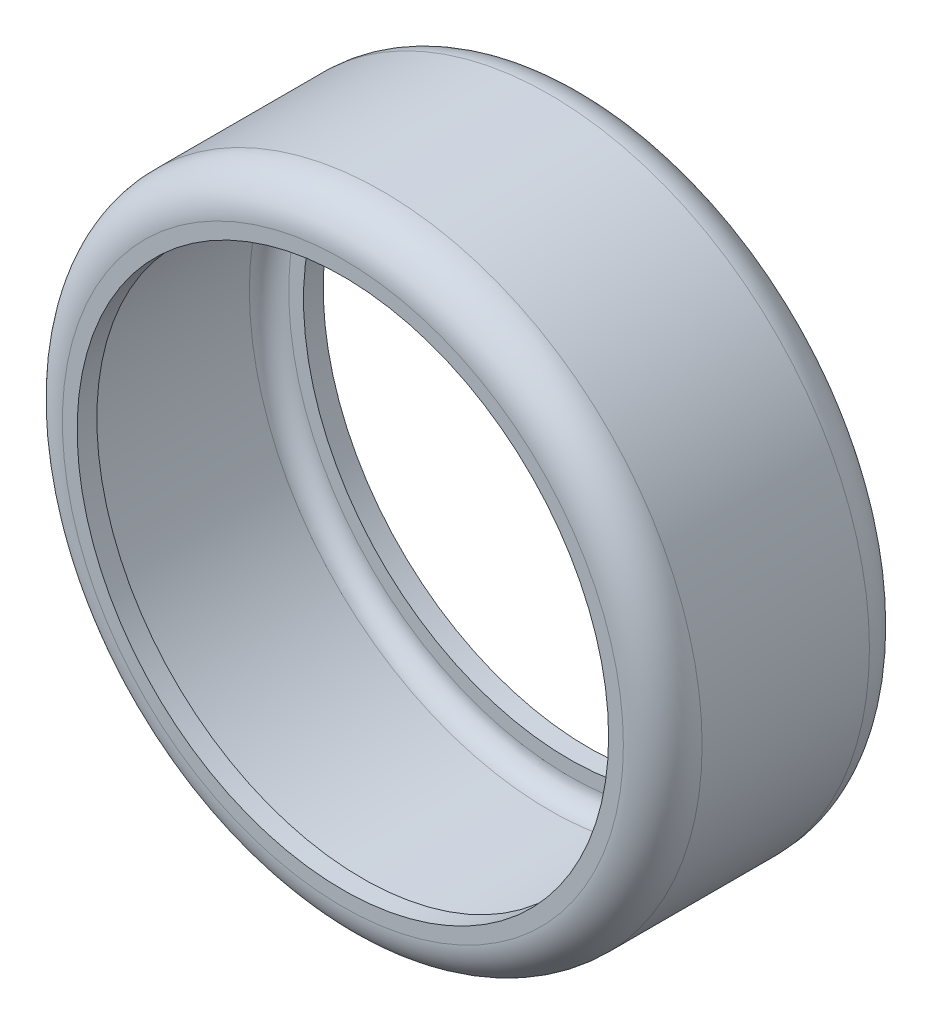
from build123d import *

# Parameters (mm, degrees)
SKETCH_1_R      = 65
SKETCH_1_R_2    = 54
EXTRUDE_1_DEPTH = 50
FILLET_1_R      = 8
SHELL_1_T       = -4


with BuildPart() as part:
    # Эскиз1 → Вытянуть-Тонкостенный1 (new body)
    with BuildSketch(Plane.XY):
        Circle(SKETCH_1_R)
        Circle(SKETCH_1_R_2, mode=Mode.SUBTRACT)
    extrude(amount=EXTRUDE_1_DEPTH)

    # Скругление1
    fillet_1_edges = [part.edges().sort_by_distance(p)[0] for p in [
        (-65, 0, 0),
        (-65, 0, 50),
    ]]
    fillet(fillet_1_edges, radius=FILLET_1_R)

    # Оболочка1
    shell_1_openings = [part.faces().sort_by_distance(p)[0] for p in [
        (-54, 0, 25),
    ]]
    offset(amount=SHELL_1_T, openings=shell_1_openings, kind=Kind.INTERSECTION)


solid = part.part
